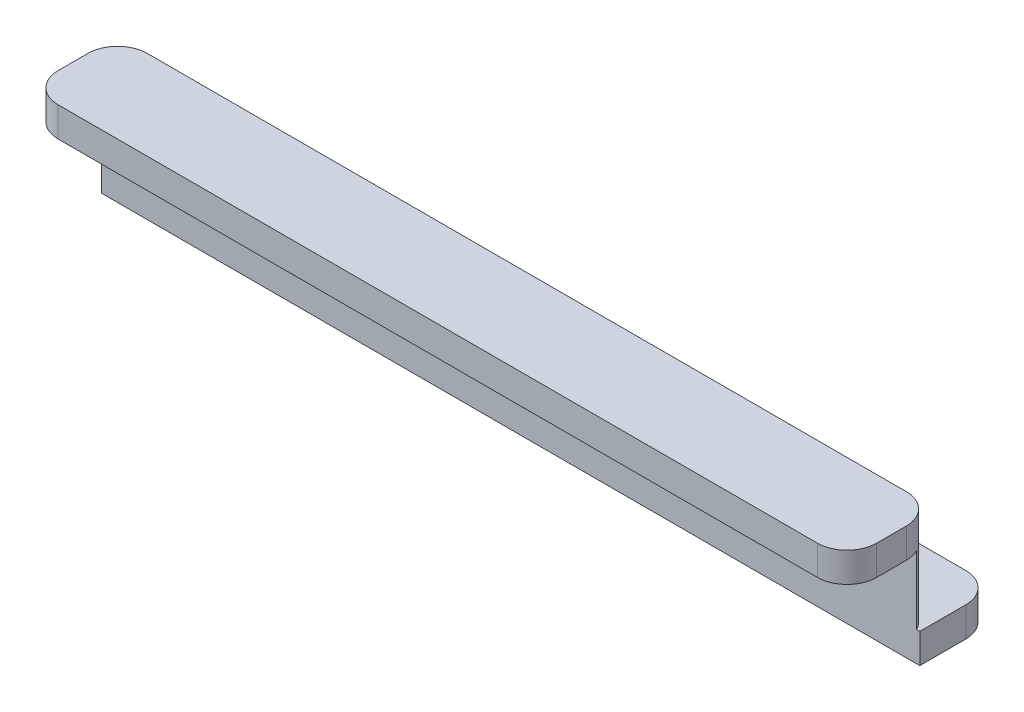
from build123d import *

# Parameters (mm, degrees)
BOSS_EXTRUDE1_DEPTH = 2
BOSS_EXTRUDE2_START = -8.6
BOSS_EXTRUDE2_DEPTH = 8.6
BOSS_EXTRUDE3_DEPTH = 2
SKETCH8_W           = 55.15
SKETCH8_H           = 4.9
CUT_EXTRUDE3_DEPTH  = 57.436535152


with BuildPart() as part:
    # Sketch1 → Boss-Extrude1 (new body)
    with BuildSketch(Plane(origin=(0, 0, 0), x_dir=(1, 0, 0), z_dir=(0, 1, 0))):
        with BuildLine():
            Line((2, 0), (53.15, 0))
            ThreePointArc((53.15, 0), (54.564213562, 0.585786438), (55.15, 2))
            Line((55.15, 2), (55.15, 4))
            ThreePointArc((55.15, 4), (54.564213562, 5.414213562), (53.15, 6))
            Line((53.15, 6), (2, 6))
            ThreePointArc((2, 6), (0.585786438, 5.414213562), (0, 4))
            Line((0, 4), (0, 2))
            ThreePointArc((0, 2), (0.585786438, 0.585786438), (2, 0))
        make_face()
    extrude(amount=BOSS_EXTRUDE1_DEPTH)

    # Sketch2 → Boss-Extrude2 (add)
    with BuildSketch(Plane(origin=(0, 2, 0), x_dir=(1, 0, 0), z_dir=(0, 1, 0)).offset(BOSS_EXTRUDE2_START)):
        with BuildLine():
            Line((1.6, 0.040408206), (1.6, 2.5))
            ThreePointArc((1.6, 2.5), (2.302943725, 4.197056275), (4, 4.9))
            Line((4, 4.9), (51.15, 4.9))
            ThreePointArc((51.15, 4.9), (52.847056275, 4.197056275), (53.55, 2.5))
            Line((53.55, 2.5), (53.55, 0.040408206))
            ThreePointArc((53.55, 0.040408206), (54.699193338, 0.735088936), (55.15, 2))
            Line((55.15, 2), (55.15, 4))
            ThreePointArc((55.15, 4), (54.564213562, 5.414213562), (53.15, 6))
            Line((53.15, 6), (2, 6))
            ThreePointArc((2, 6), (0.585786438, 5.414213562), (0, 4))
            Line((0, 4), (0, 2))
            ThreePointArc((0, 2), (0.450806662, 0.735088936), (1.6, 0.040408206))
        make_face()
    extrude(amount=BOSS_EXTRUDE2_DEPTH)

    # Sketch4 → Boss-Extrude3 (add)
    with BuildSketch(Plane.XZ.offset(6.6)):
        with BuildLine():
            Line((0, -4), (0, -8))
            ThreePointArc((0, -8), (0.585786438, -9.414213562), (2, -10))
            Line((2, -10), (53.15, -10))
            ThreePointArc((53.15, -10), (54.564213562, -9.414213562), (55.15, -8))
            Line((55.15, -8), (55.15, -4))
            ThreePointArc((55.15, -4), (54.564213562, -5.414213562), (53.15, -6))
            Line((53.15, -6), (2, -6))
            ThreePointArc((2, -6), (0.585786438, -5.414213562), (0, -4))
        make_face()
    extrude(amount=-BOSS_EXTRUDE3_DEPTH)

    # Sketch8 → Cut-Extrude3 (cut, through all)
    with BuildSketch(Plane.XZ):
        with Locations((27.575, -2.45)):
            Rectangle(SKETCH8_W, SKETCH8_H)
    extrude(amount=CUT_EXTRUDE3_DEPTH, mode=Mode.SUBTRACT)


solid = part.part
